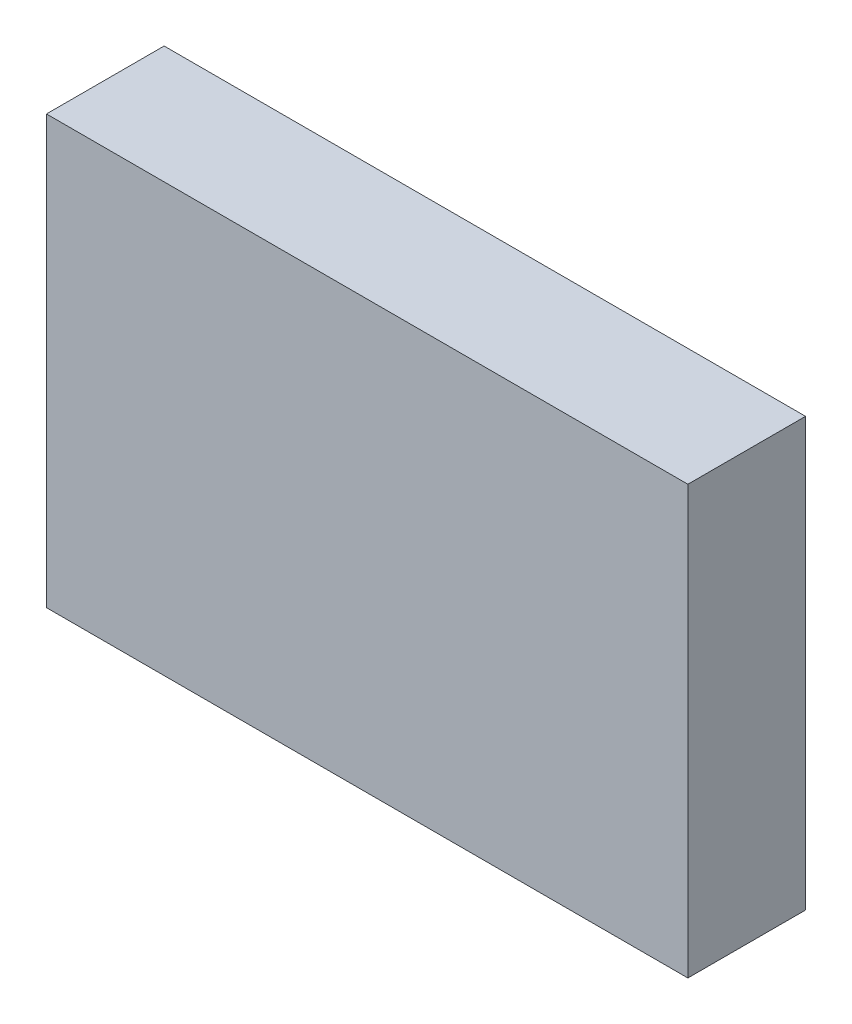
from build123d import *

# Parameters (mm, degrees)
SKETCH1_W           = 180
SKETCH1_H           = 120
BOSS_EXTRUDE1_DEPTH = 33.02


with BuildPart() as part:
    # Sketch1 → Boss-Extrude1 (new body)
    with BuildSketch(Plane.XY):
        Rectangle(SKETCH1_W, SKETCH1_H)
    extrude(amount=BOSS_EXTRUDE1_DEPTH)


solid = part.part
